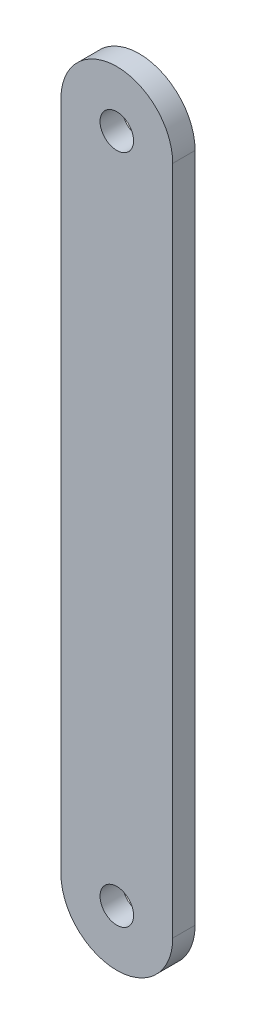
from build123d import *

# Parameters (mm, degrees)
SKETCH_1_R      = 1.5
EXTRUDE_1_DEPTH = 2


with BuildPart() as part:
    # 草图1 → 凸台-拉伸1 (new body)
    with BuildSketch(Plane.XY):
        with BuildLine():
            Line((-5, -30), (-5, 30))
            ThreePointArc((-5, 30), (0, 35), (5, 30))
            Line((5, 30), (5, -30))
            ThreePointArc((5, -30), (0, -35), (-5, -30))
        make_face()
        with Locations((0, 30)):
            Circle(SKETCH_1_R, mode=Mode.SUBTRACT)
        with Locations(Location((0, -30, 0), (0, 0, 180))):
            Circle(SKETCH_1_R, mode=Mode.SUBTRACT)
    extrude(amount=EXTRUDE_1_DEPTH)


solid = part.part
